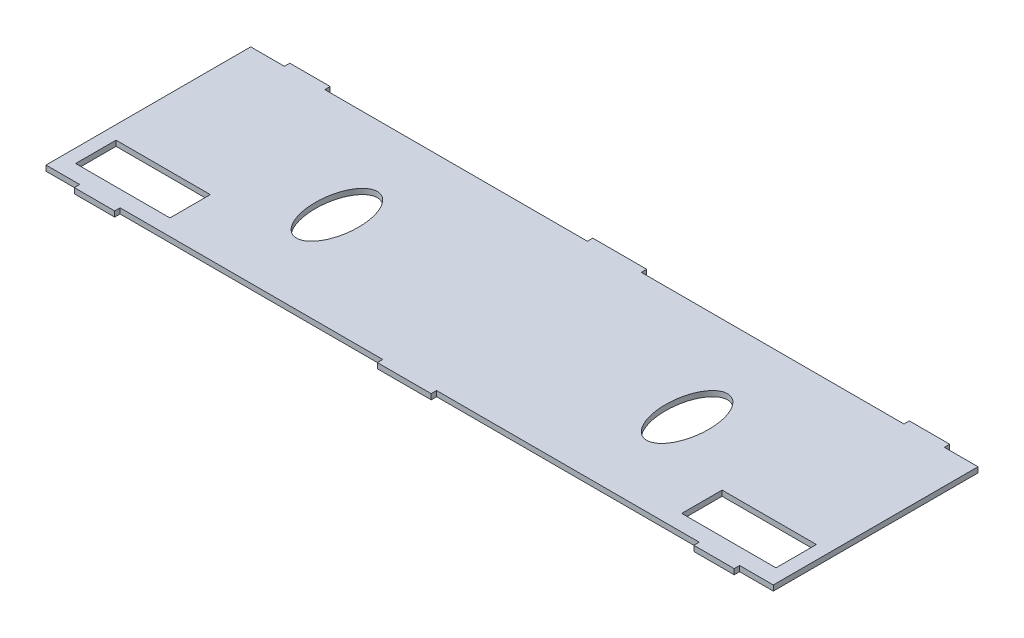
from build123d import *

# Parameters (mm, degrees)
SKETCH_1_RX         = 15
SKETCH_1_RY         = 8
EXTRUDE_1_DEPTH     = 2
SKETCH_2_W          = 35
SKETCH_2_H          = 15
CUT_EXTRUDE_1_DEPTH = 141.815482103


with BuildPart() as part:
    # 草图1 → 凸台-拉伸1 (new body)
    with BuildSketch(Plane(origin=(0, 0, 0), x_dir=(1, 0, 0), z_dir=(0, 1, 0))):
        Polygon((-107.5, 38), (-10, 38), (-10, 40), (10, 40), (10, 38), (107.5, 38), (107.5, 40), (122.5, 40), (122.5, 38), (135, 38), (135, -38), (122.5, -38), (122.5, -40), (107.5, -40), (107.5, -38), (10, -38), (10, -40), (-10, -40), (-10, -38), (-107.5, -38), (-107.5, -40), (-122.5, -40), (-122.5, -38), (-135, -38), (-135, 38), (-122.5, 38), (-122.5, 40), (-107.5, 40), align=None)
        with Locations(Location((-65, 0), (0, 0, 90))):
            Ellipse(SKETCH_1_RX, SKETCH_1_RY, mode=Mode.SUBTRACT)
        with Locations(Location((65, 0), (0, 0, 90))):
            Ellipse(SKETCH_1_RX, SKETCH_1_RY, mode=Mode.SUBTRACT)
    extrude(amount=EXTRUDE_1_DEPTH)

    # 草图2 → 切除-拉伸1 (cut, through all)
    with BuildSketch(Plane.XZ):
        with Locations((-112.5, 24.5)):
            Rectangle(SKETCH_2_W, SKETCH_2_H)
    cut_extrude_1 = extrude(amount=-CUT_EXTRUDE_1_DEPTH, mode=Mode.SUBTRACT)

    # 镜向1: 切除-拉伸1 across plane
    add(cut_extrude_1.mirror(Plane(origin=(0, 0, 0), x_dir=(0, 0, 1), z_dir=(1, 0, 0))), mode=Mode.SUBTRACT)


solid = part.part
